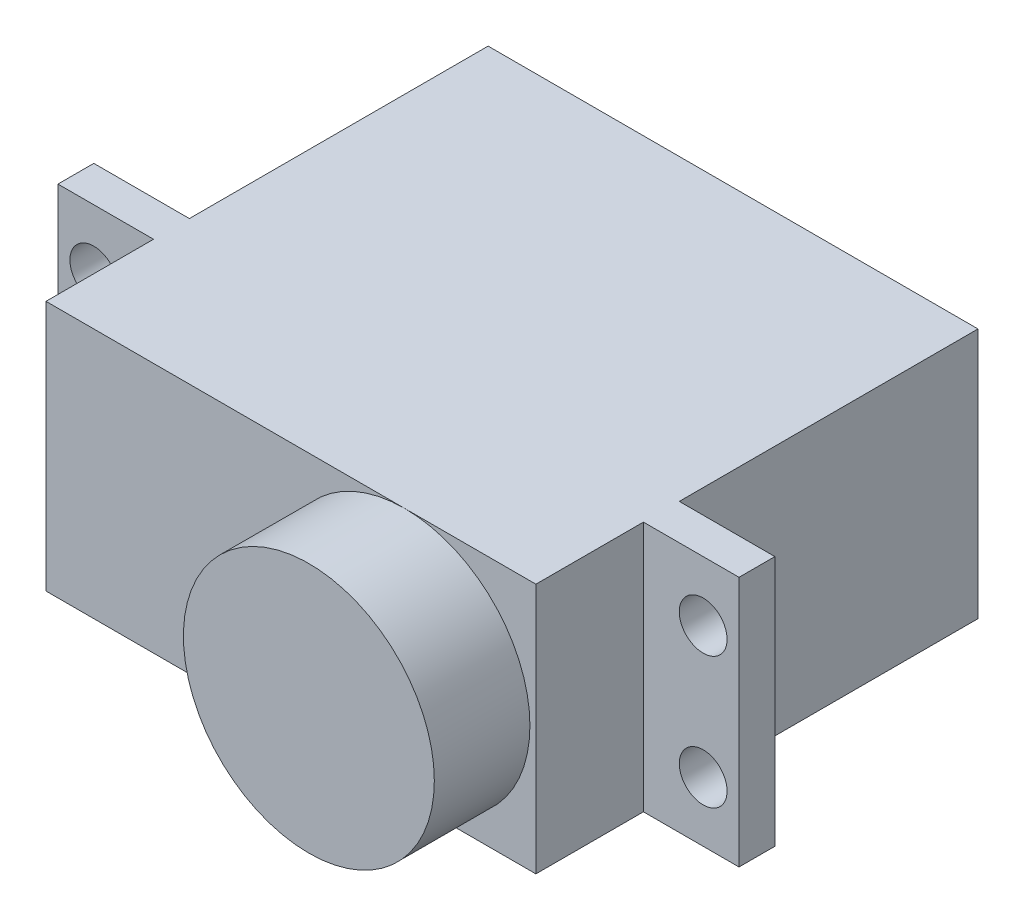
from build123d import *

# Parameters (mm, degrees)
SKETCH1_W           = 41
SKETCH1_H           = 21
BOSS_EXTRUDE1_DEPTH = 25
BOSS_EXTRUDE2_DEPTH = 3
SKETCH5_W           = 41
SKETCH5_H           = 21
BOSS_EXTRUDE3_DEPTH = 9
SKETCH6_R           = 2
CUT_EXTRUDE1_DEPTH  = 9
SKETCH7_R           = 2
CUT_EXTRUDE2_DEPTH  = 9
SKETCH8_R           = 10.5
BOSS_EXTRUDE4_DEPTH = 8


with BuildPart() as part:
    # Sketch1 → Boss-Extrude1 (new body)
    with BuildSketch(Plane.XY):
        with Locations((-25.101821211, -5.243485894)):
            Rectangle(SKETCH1_W, SKETCH1_H)
    extrude(amount=BOSS_EXTRUDE1_DEPTH)

    # Sketch4 → Boss-Extrude2 (add)
    with BuildSketch(Plane.XY.offset(25)):
        Polygon((-4.601821211, 5.256514106), (-45.601821211, 5.256514106), (-53.601821211, 5.256514106), (-53.601821211, -15.743485894), (-45.601821211, -15.743485894), (-4.601821211, -15.743485894), (3.398178789, -15.743485894), (3.398178789, 5.256514106), align=None)
    extrude(amount=BOSS_EXTRUDE2_DEPTH)

    # Sketch5 → Boss-Extrude3 (add)
    with BuildSketch(Plane.XY.offset(28)):
        with Locations((-25.101821211, -5.243485894)):
            Rectangle(SKETCH5_W, SKETCH5_H)
    extrude(amount=BOSS_EXTRUDE3_DEPTH)

    # Sketch6 → Cut-Extrude1 (cut)
    with BuildSketch(Plane.XY.offset(28)):
        with Locations((-50.601821211, -10.743485894)):
            Circle(SKETCH6_R)
        with Locations((-50.601821211, 0.256514106)):
            Circle(SKETCH6_R)
    extrude(amount=-CUT_EXTRUDE1_DEPTH, mode=Mode.SUBTRACT)

    # Sketch7 → Cut-Extrude2 (cut)
    with BuildSketch(Plane.XY.offset(28)):
        with Locations((0.398178789, -10.743485894)):
            Circle(SKETCH7_R)
        with Locations((0.398178789, 0.256514106)):
            Circle(SKETCH7_R)
    extrude(amount=-CUT_EXTRUDE2_DEPTH, mode=Mode.SUBTRACT)

    # Sketch8 → Boss-Extrude4 (add)
    with BuildSketch(Plane.XY.offset(37)):
        with Locations(Location((-15.601821211, -5.243485894, 0), (0, 0, 270))):
            Circle(SKETCH8_R)
    extrude(amount=BOSS_EXTRUDE4_DEPTH)


solid = part.part
